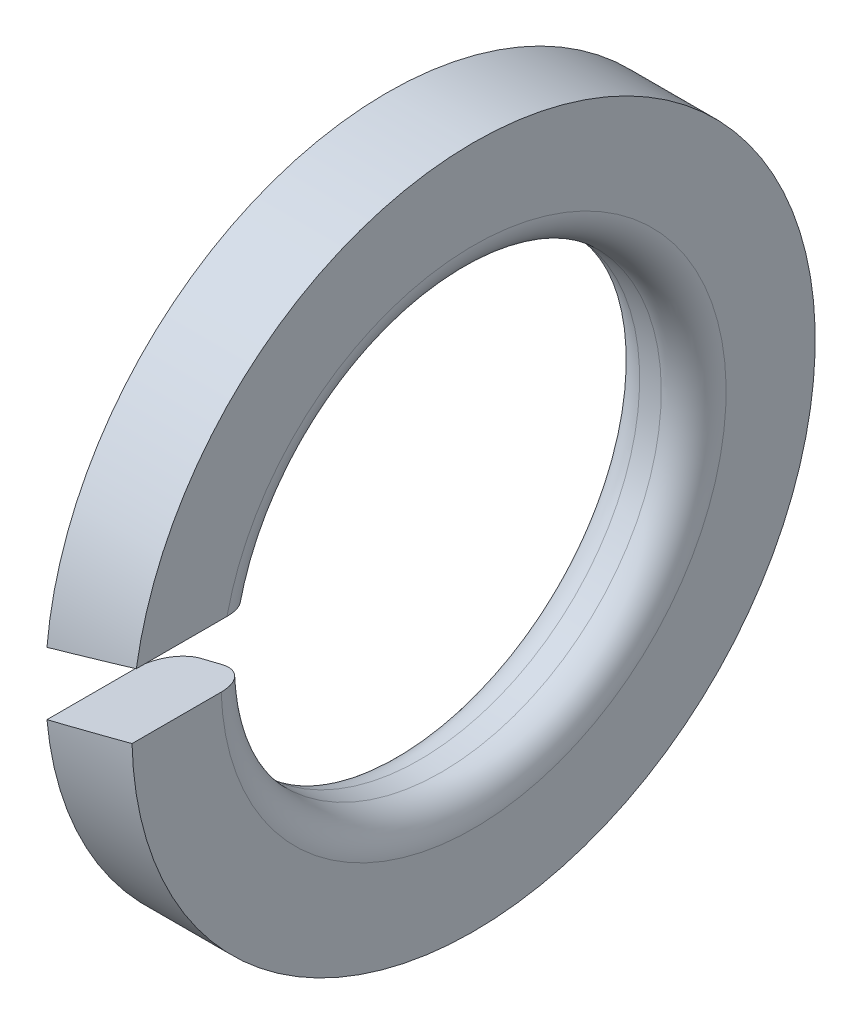
from build123d import *
from build123d.topology import SkipClean

# Parameters (mm, degrees)
SZKIC1_W                   = 3.2
SZKIC1_H                   = 4.5
OBR_T1_ANGLE               = 180
OBR_T1_OTHER_WAY_ANGLE     = 180
WYTNIJ_WYCI_GNI_CIE1_DEPTH = 32.6


with BuildPart() as part:
    # Szkic1 → Obrót1 (revolve)
    with BuildSketch(Plane(origin=(0, 0, 0), x_dir=(1, 0, 0), z_dir=(0, 1, 0))):
        with Locations((1.6, 10.4)):
            Rectangle(SZKIC1_W, SZKIC1_H)
    revolve(axis=Axis((1, 0, 0), (-1, 0, 0)), revolution_arc=OBR_T1_ANGLE)

    # Szkic1 → Obrót1 other way (revolve)
    with SkipClean():  # the faces are left unmerged after this step: merging them gives an invalid solid
        with BuildSketch(Plane(origin=(0, 0, 0), x_dir=(1, 0, 0), z_dir=(0, 1, 0))):
            with Locations((1.6, 10.4)):
                Rectangle(SZKIC1_W, SZKIC1_H)
        revolve(axis=Axis((1, 0, 0), (1, 0, 0)), revolution_arc=OBR_T1_OTHER_WAY_ANGLE)

    # Szkic2 → Wytnij-wyciągnięcie1 (cut)
    with BuildSketch(Plane.XY):
        Polygon((-3.2, 0.302071906), (-3.2, -2.016946738), (4.85, 0.140044261), (4.85, 2.459062905), align=None)
    extrude(amount=WYTNIJ_WYCI_GNI_CIE1_DEPTH, mode=Mode.SUBTRACT)

    # Szkic3 → Wycięcie-obrót1 (revolve, cut)
    with BuildSketch(Plane.XY):
        with BuildLine():
            Line((0, 5.433333333), (3.2, 5.433333333))
            Line((3.2, 5.433333333), (3.2, 9.35))
            ThreePointArc((3.2, 9.35), (2.848528137, 8.501471863), (2, 8.15))
            Line((2, 8.15), (1.2, 8.15))
            ThreePointArc((1.2, 8.15), (0.351471863, 8.501471863), (0, 9.35))
            Line((0, 9.35), (0, 5.433333333))
        make_face()
    revolve(axis=Axis((1, 0, 0), (-1, 0, 0)), mode=Mode.SUBTRACT)


solid = part.part
